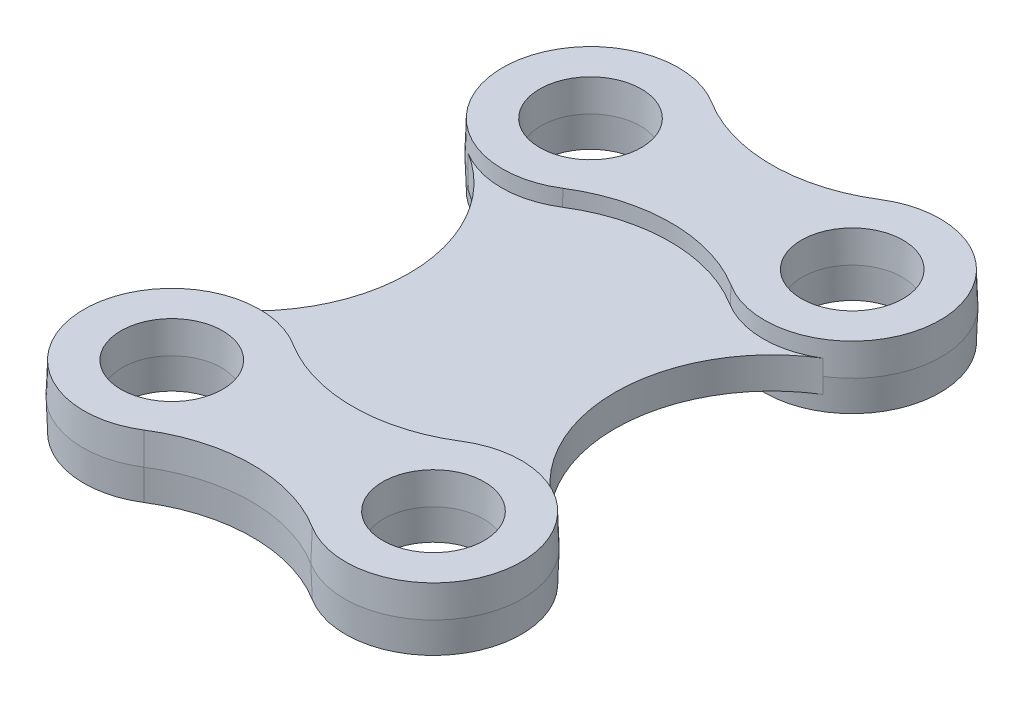
from build123d import *

# Parameters (mm, degrees)
BOSS_EXTRUDE2_DEPTH           = 3
SKETCH1_4_R                   = 9.5
BOSS_EXTRUDE3_DEPTH           = 6
BOSS_EXTRUDE3_TAPER           = 2
BOSS_EXTRUDE3_OTHER_WAY_DEPTH = 6
BOSS_EXTRUDE3_OTHER_WAY_TAPER = 2


with BuildPart() as part:
    # Sketch1 → Boss-Extrude2 (new, symmetric)
    with BuildSketch(Plane(origin=(0, 0, 0), x_dir=(1, 0, 0), z_dir=(0, 1, 0))):
        with BuildLine():
            ThreePointArc((15.957446809, -25.60443708), (24.931387734, -23.000138461), (33.926058108, -25.531914894))
            ThreePointArc((33.926058108, -25.531914894), (19.677925359, 0), (33.926058108, 25.531914894))
            ThreePointArc((33.926058108, 25.531914894), (24.931387734, 23.000138461), (15.957446809, 25.60443708))
            ThreePointArc((15.957446809, 25.60443708), (0, 30.200502516), (-15.957446809, 25.60443708))
            ThreePointArc((-15.957446809, 25.60443708), (-24.931387734, 23.000138461), (-33.926058108, 25.531914894))
            ThreePointArc((-33.926058108, 25.531914894), (-19.677925359, 0), (-33.926058108, -25.531914894))
            ThreePointArc((-33.926058108, -25.531914894), (-24.931387734, -23.000138461), (-15.957446809, -25.60443708))
            ThreePointArc((-15.957446809, -25.60443708), (0, -30.200502516), (15.957446809, -25.60443708))
        make_face()
    extrude(amount=BOSS_EXTRUDE2_DEPTH, both=True)



with BuildPart() as body_2:
    # Sketch1<4> → Boss-Extrude3 (new body)
    # profile 1 of 2: a face of its own
    with BuildSketch(Plane(origin=(0, 0, 0), x_dir=(1, 0, 0), z_dir=(0, 1, 0))):
        with BuildLine():
            ThreePointArc((15.957446809, 54.39556292), (0, 49.799497484), (-15.957446809, 54.39556292))
            ThreePointArc((-15.957446809, 54.39556292), (-42, 40), (-15.957446809, 25.60443708))
            ThreePointArc((-15.957446809, 25.60443708), (0, 30.200502516), (15.957446809, 25.60443708))
            ThreePointArc((15.957446809, 25.60443708), (42, 40), (15.957446809, 54.39556292))
        make_face()
        with Locations((-25, 40)):
            Circle(SKETCH1_4_R, mode=Mode.SUBTRACT)
        with Locations((25, 40)):
            Circle(SKETCH1_4_R, mode=Mode.SUBTRACT)
    # profile 2 of 2: a face of its own
    with BuildSketch(Plane(origin=(0, 0, 0), x_dir=(1, 0, 0), z_dir=(0, 1, 0))):
        with BuildLine():
            ThreePointArc((-15.957446809, -25.60443708), (-42, -40), (-15.957446809, -54.39556292))
            ThreePointArc((-15.957446809, -54.39556292), (0, -49.799497484), (15.957446809, -54.39556292))
            ThreePointArc((15.957446809, -54.39556292), (42, -40), (15.957446809, -25.60443708))
            ThreePointArc((15.957446809, -25.60443708), (0, -30.200502516), (-15.957446809, -25.60443708))
        make_face()
        with Locations((25, -40)):
            Circle(SKETCH1_4_R, mode=Mode.SUBTRACT)
        with Locations((-25, -40)):
            Circle(SKETCH1_4_R, mode=Mode.SUBTRACT)
    extrude(amount=BOSS_EXTRUDE3_DEPTH, taper=BOSS_EXTRUDE3_TAPER)


with BuildPart() as part_1:
    add(part.part)

    add(body_2.part)  # Boss-Extrude3 other way merges body 2
    # Sketch1<4> → Boss-Extrude3 other way (add)
    # profile 1 of 2: a face of its own
    with BuildSketch(Plane(origin=(0, 0, 0), x_dir=(1, 0, 0), z_dir=(0, 1, 0))):
        with BuildLine():
            ThreePointArc((15.957446809, 54.39556292), (0, 49.799497484), (-15.957446809, 54.39556292))
            ThreePointArc((-15.957446809, 54.39556292), (-42, 40), (-15.957446809, 25.60443708))
            ThreePointArc((-15.957446809, 25.60443708), (0, 30.200502516), (15.957446809, 25.60443708))
            ThreePointArc((15.957446809, 25.60443708), (42, 40), (15.957446809, 54.39556292))
        make_face()
        with Locations((-25, 40)):
            Circle(SKETCH1_4_R, mode=Mode.SUBTRACT)
        with Locations((25, 40)):
            Circle(SKETCH1_4_R, mode=Mode.SUBTRACT)
    # profile 2 of 2: a face of its own
    with BuildSketch(Plane(origin=(0, 0, 0), x_dir=(1, 0, 0), z_dir=(0, 1, 0))):
        with BuildLine():
            ThreePointArc((-15.957446809, -25.60443708), (-42, -40), (-15.957446809, -54.39556292))
            ThreePointArc((-15.957446809, -54.39556292), (0, -49.799497484), (15.957446809, -54.39556292))
            ThreePointArc((15.957446809, -54.39556292), (42, -40), (15.957446809, -25.60443708))
            ThreePointArc((15.957446809, -25.60443708), (0, -30.200502516), (-15.957446809, -25.60443708))
        make_face()
        with Locations((25, -40)):
            Circle(SKETCH1_4_R, mode=Mode.SUBTRACT)
        with Locations((-25, -40)):
            Circle(SKETCH1_4_R, mode=Mode.SUBTRACT)
    extrude(amount=-BOSS_EXTRUDE3_OTHER_WAY_DEPTH, taper=BOSS_EXTRUDE3_OTHER_WAY_TAPER)


solid = part_1.part
